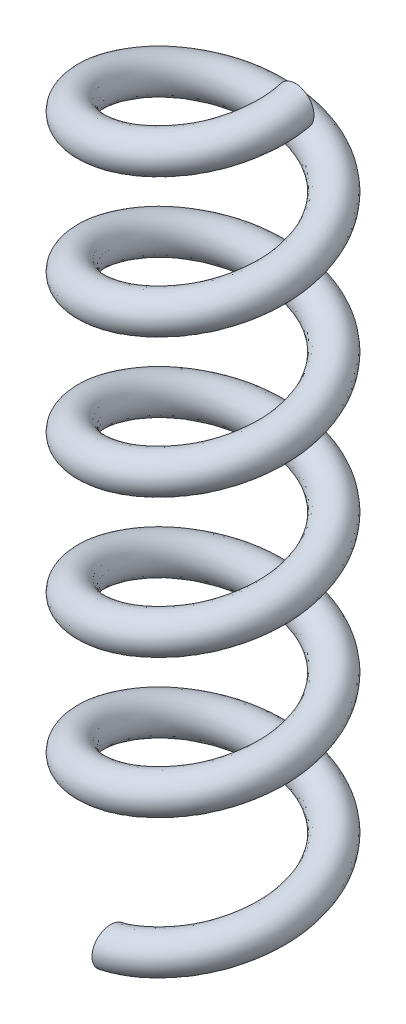
from build123d import *

# Parameters (mm, degrees)
BALAYAGE2_PITCH  = 3
BALAYAGE2_HEIGHT = 15.75
BALAYAGE2_RADIUS = 2
ESQUISSE28_R     = 0.4


with BuildPart() as part:
    # Balayage2: sweep along a helix
    with BuildLine() as balayage2_path:
        Helix(BALAYAGE2_PITCH, BALAYAGE2_HEIGHT, BALAYAGE2_RADIUS, center=(0, 0, 0), direction=(0, 1, 0))
    # Esquisse28 → Balayage2 (sweep)
    with BuildSketch(Plane(origin=(0, 0, 0), x_dir=(0, 0, -1), z_dir=(1, 0, 0))):
        with Locations((-2, 0)):
            Circle(ESQUISSE28_R)
    sweep(path=balayage2_path.line, is_frenet=True)


solid = part.part
